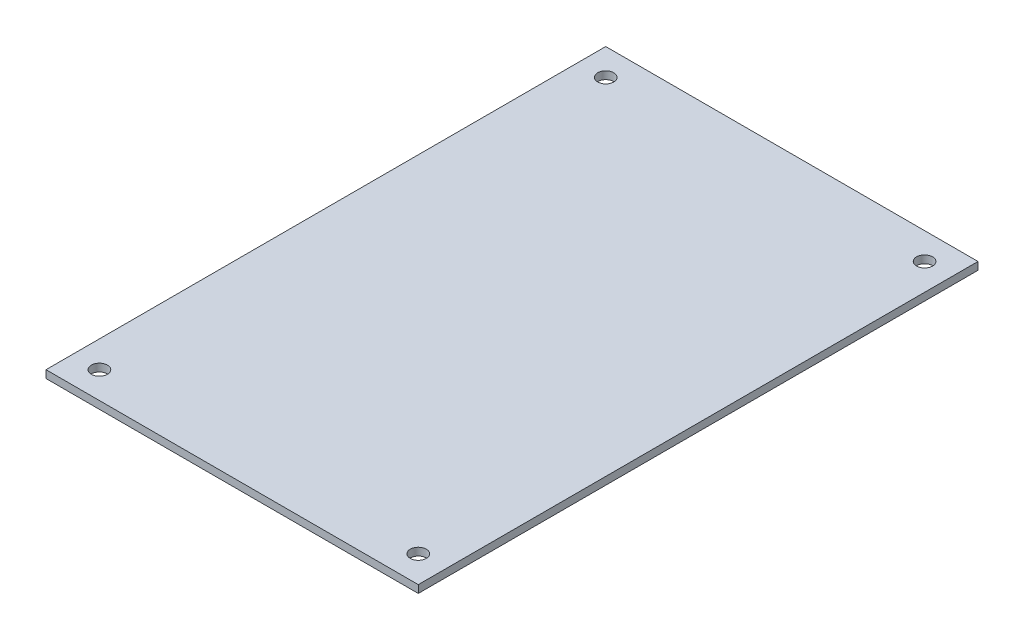
from build123d import *

# Parameters (mm, degrees)
SKETCH1_W               = 78.9432
SKETCH1_H               = 118.6942
BOSS_EXTRUDE1_DEPTH     = 1.6256
CUT_EXTRUDE1_REACH      = 73.293
SKETCH2_R               = 1.7018
MIRROR2_COPY_1_REACH    = 73.293
MIRROR2_COPY_1_SKETCH_R = 1.7018


with BuildPart() as part:
    # Sketch1 → Boss-Extrude1 (new body)
    with BuildSketch(Plane(origin=(0, 0, 0), x_dir=(1, 0, 0), z_dir=(0, 1, 0))):
        Rectangle(SKETCH1_W, SKETCH1_H)
    extrude(amount=BOSS_EXTRUDE1_DEPTH)

    # Sketch2 → Cut-Extrude1 (cut, up to next)
    with BuildSketch(Plane(origin=(0, 1.6256, 0), x_dir=(1, 0, 0), z_dir=(0, 1, 0)), mode=Mode.PRIVATE) as cut_extrude1_sk1:
        with Locations(Location((-33.8074, 53.6829, 0), (0, 0, 270))):
            Circle(SKETCH2_R)
    cut_extrude1_tool1 = extrude(cut_extrude1_sk1.sketch, amount=-CUT_EXTRUDE1_REACH, mode=Mode.PRIVATE) & part.part
    cut_extrude1 = cut_extrude1_tool1.solids().sort_by_distance((-33.8074, 1.6256, -53.6829))[0]
    add(cut_extrude1, mode=Mode.SUBTRACT)

    # Mirror1: Cut-Extrude1 across plane
    add(cut_extrude1.mirror(Plane(origin=(0, 0, 0), x_dir=(0, 0, 1), z_dir=(1, 0, 0))), mode=Mode.SUBTRACT)

    # Mirror2: Cut-Extrude1 across plane
    add(cut_extrude1.mirror(Plane.XY), mode=Mode.SUBTRACT)

    # Mirror2 copy 1 sketch → Mirror2 copy 1 (cut, up to next)
    with BuildSketch(Plane(origin=(0, 1.6256, 0), x_dir=(-1, 0, 0), z_dir=(0, 1, 0)), mode=Mode.PRIVATE) as mirror2_copy_1_sk1:
        with Locations(Location((-33.8074, 53.6829, 0), (0, 0, 270))):
            Circle(MIRROR2_COPY_1_SKETCH_R)
    mirror2_copy_1_tool1 = extrude(mirror2_copy_1_sk1.sketch, amount=-MIRROR2_COPY_1_REACH, mode=Mode.PRIVATE) & part.part
    add(mirror2_copy_1_tool1.solids().sort_by_distance((33.8074, 1.6256, 53.6829))[0], mode=Mode.SUBTRACT)


solid = part.part
